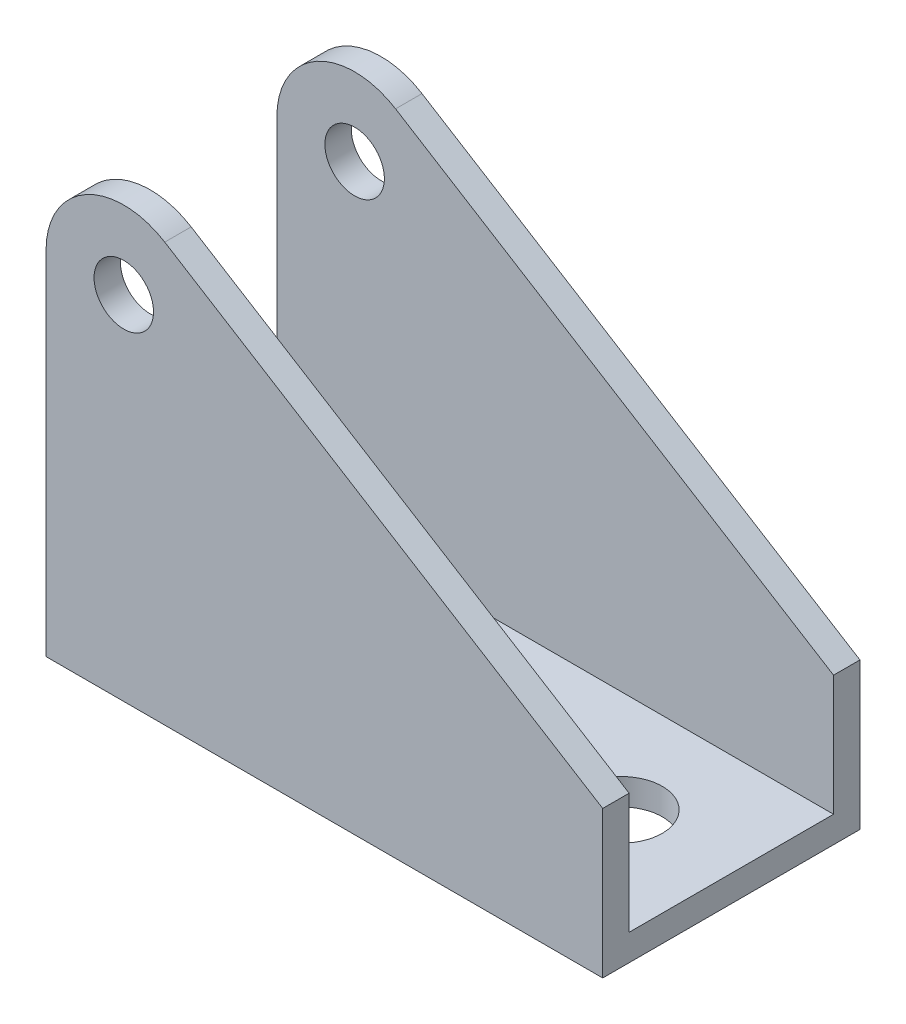
from build123d import *

# Parameters (mm, degrees)
SKETCH1_R           = 4.25
BOSS_EXTRUDE1_DEPTH = 2.75
BOSS_EXTRUDE2_START = 13.4
SKETCH2_R           = 3.1
BOSS_EXTRUDE2_DEPTH = 2.75
BOSS_EXTRUDE3_START = -10.65
SKETCH2_2_R         = 3.1
BOSS_EXTRUDE3_DEPTH = 2.75


with BuildPart() as part:
    # Sketch1 → Boss-Extrude1 (new body)
    with BuildSketch(Plane(origin=(0, 0, 0), x_dir=(1, 0, 0), z_dir=(0, 1, 0))):
        with BuildLine():
            Line((-46.55, 4.25), (-36.5, 4.25))
            ThreePointArc((-36.5, 4.25), (-33.49479618, 3.00520382), (-32.25, 0))
            ThreePointArc((-32.25, 0), (-33.49479618, -3.00520382), (-36.5, -4.25))
            Line((-36.5, -4.25), (-46.55, -4.25))
            Line((-46.55, -4.25), (-46.55, -13.4))
            Line((-46.55, -13.4), (11.45, -13.4))
            Line((11.45, -13.4), (11.45, 13.4))
            Line((11.45, 13.4), (-46.55, 13.4))
            Line((-46.55, 13.4), (-46.55, 4.25))
        make_face()
        with Locations(Location((0, 0, 0), (0, 0, 270))):
            Circle(SKETCH1_R, mode=Mode.SUBTRACT)
    extrude(amount=BOSS_EXTRUDE1_DEPTH)

    # Sketch2 → Boss-Extrude2 (add)
    with BuildSketch(Plane.XY.offset(BOSS_EXTRUDE2_START)):
        with BuildLine():
            Line((-46.55, 0), (-46.55, 36.7))
            ThreePointArc((-46.55, 36.7), (-42.389803721, 43.777283846), (-34.182605767, 43.584718328))
            Line((-34.182605767, 43.584718328), (11.45, 15.3))
            Line((11.45, 15.3), (11.45, 0))
            Line((11.45, 0), (-46.55, 0))
        make_face()
        with Locations(Location((-38.45, 36.7, 0), (0, 0, 180))):
            Circle(SKETCH2_R, mode=Mode.SUBTRACT)
    extrude(amount=-BOSS_EXTRUDE2_DEPTH)

    # Sketch2<2> → Boss-Extrude3 (add)
    with BuildSketch(Plane.XY.offset(BOSS_EXTRUDE3_START)):
        with BuildLine():
            Line((-46.55, 0), (-46.55, 36.7))
            ThreePointArc((-46.55, 36.7), (-42.389803721, 43.777283846), (-34.182605767, 43.584718328))
            Line((-34.182605767, 43.584718328), (11.45, 15.3))
            Line((11.45, 15.3), (11.45, 0))
            Line((11.45, 0), (-46.55, 0))
        make_face()
        with Locations(Location((-38.45, 36.7, 0), (0, 0, 180))):
            Circle(SKETCH2_2_R, mode=Mode.SUBTRACT)
    extrude(amount=-BOSS_EXTRUDE3_DEPTH)


solid = part.part
